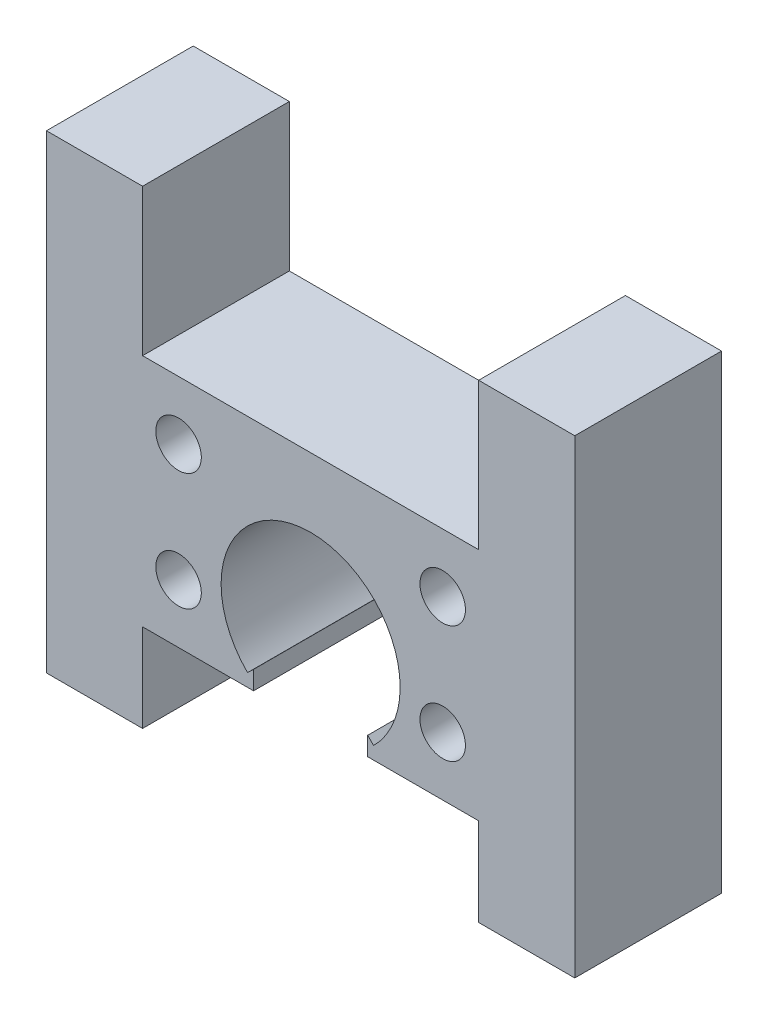
from build123d import *

# Parameters (mm, degrees)
SZKIC1_W                    = 36
SZKIC1_H                    = 16
DODANIE_WYCI_GNI_CIE1_DEPTH = 10
WYTNIJ_WYCI_GNI_CIE1_DEPTH  = 10
SZKIC3_R                    = 1.55
WYTNIJ_WYCI_GNI_CIE2_DEPTH  = 74.950499929
SZKIC4_W                    = 6.55
SZKIC4_H                    = 10
DODANIE_WYCI_GNI_CIE2_DEPTH = 6
SZKIC5_W                    = 6.55
SZKIC5_H                    = 10
DODANIE_WYCI_GNI_CIE3_DEPTH = 10


with BuildPart() as part:
    # Szkic1 → Dodanie-wyciągnięcie1 (new body)
    with BuildSketch(Plane.XY):
        with Locations((53.502982034, -8)):
            Rectangle(SZKIC1_W, SZKIC1_H)
    extrude(amount=-DODANIE_WYCI_GNI_CIE1_DEPTH)

    # Szkic2 → Wytnij-wyciągnięcie1 (cut)
    with BuildSketch(Plane(origin=(0, 0, -10), x_dir=(-1, 0, 0), z_dir=(0, 0, -1))):
        with BuildLine():
            Line((-57.391426453, -16), (-49.614537615, -16))
            Line((-49.614537615, -16), (-49.614537615, -14.730541148))
            Line((-49.614537615, -14.730541148), (-49.204397396, -15.128067711))
            ThreePointArc((-49.204397396, -15.128067711), (-53.507441674, -4.70000163), (-57.795233679, -15.134348373))
            Line((-57.795233679, -15.134348373), (-57.391426453, -14.730541148))
            Line((-57.391426453, -14.730541148), (-57.391426453, -16))
        make_face()
    extrude(amount=-WYTNIJ_WYCI_GNI_CIE1_DEPTH, mode=Mode.SUBTRACT)

    # Szkic3 → Wytnij-wyciągnięcie2 (cut, through all)
    with BuildSketch(Plane(origin=(0, 0, -10), x_dir=(-1, 0, 0), z_dir=(0, 0, -1))):
        with Locations((-44.502982034, -12)):
            Circle(SZKIC3_R)
        with Locations((-44.502982034, -4)):
            Circle(SZKIC3_R)
        with Locations((-62.502982034, -12)):
            Circle(SZKIC3_R)
        with Locations((-62.502982034, -4)):
            Circle(SZKIC3_R)
    extrude(amount=-WYTNIJ_WYCI_GNI_CIE2_DEPTH, mode=Mode.SUBTRACT)

    # Szkic4 → Dodanie-wyciągnięcie2 (add)
    with BuildSketch(Plane.XZ.offset(16)):
        with Locations((68.227982034, -5)):
            Rectangle(SZKIC4_W, SZKIC4_H)
        with Locations((38.777982035, -5)):
            Rectangle(SZKIC4_W, SZKIC4_H)
    extrude(amount=DODANIE_WYCI_GNI_CIE2_DEPTH)

    # Szkic5 → Dodanie-wyciągnięcie3 (add)
    with BuildSketch(Plane(origin=(0, 0, 0), x_dir=(1, 0, 0), z_dir=(0, 1, 0))):
        with Locations((68.227982034, 5)):
            Rectangle(SZKIC5_W, SZKIC5_H)
        with Locations((38.777982035, 5)):
            Rectangle(SZKIC5_W, SZKIC5_H)
    extrude(amount=DODANIE_WYCI_GNI_CIE3_DEPTH)


solid = part.part
